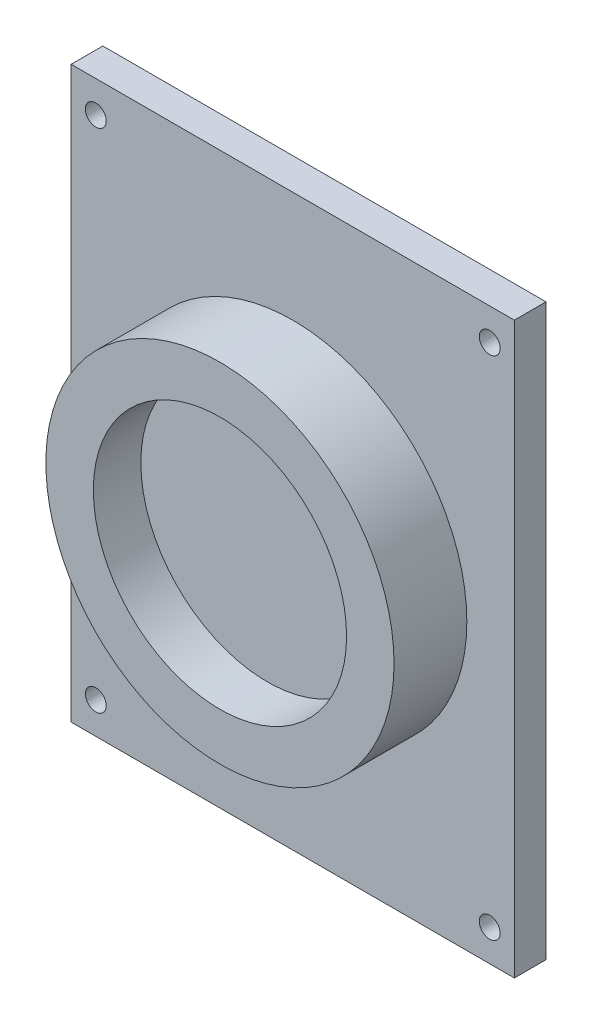
from build123d import *

# Parameters (mm, degrees)
CROQUIS1_W                                           = 140
CROQUIS1_H                                           = 180
SALIENTE_EXTRUIR1_DEPTH                              = 10
CROQUIS2_R                                           = 55
SALIENTE_EXTRUIR2_DEPTH                              = 8
CROQUIS3_R                                           = 55
CROQUIS3_R_2                                         = 40
SALIENTE_EXTRUIR3_DEPTH                              = 15
REFRENTADO_PARA_TORNILLO_CON_CABEZA_PLAN_D           = 6.6
REFRENTADO_PARA_TORNILLO_CON_CABEZA_PLAN_CBORE_D     = 11
REFRENTADO_PARA_TORNILLO_CON_CABEZA_PLAN_CBORE_DEPTH = 3.9


with BuildPart() as part:
    # Croquis1 → Saliente-Extruir1 (new body)
    with BuildSketch(Plane.XY):
        with Locations((70, 90)):
            Rectangle(CROQUIS1_W, CROQUIS1_H)
    extrude(amount=SALIENTE_EXTRUIR1_DEPTH)

    # Croquis2 → Saliente-Extruir2 (add)
    with BuildSketch(Plane.XY.offset(10)):
        with Locations((70, 90)):
            Circle(CROQUIS2_R)
    extrude(amount=SALIENTE_EXTRUIR2_DEPTH)

    # Croquis3 → Saliente-Extruir3 (add)
    with BuildSketch(Plane.XY.offset(18)):
        with Locations((70, 90)):
            Circle(CROQUIS3_R)
        with Locations((70, 90)):
            Circle(CROQUIS3_R_2, mode=Mode.SUBTRACT)
    extrude(amount=SALIENTE_EXTRUIR3_DEPTH)

    # Refrentado para tornillo con cabeza plana de M61 (through all)
    with Locations(Plane(origin=(0, 0, 0), x_dir=(-1, 0, 0), z_dir=(0, 0, -1))):
        with Locations((-132.222222222, 170), (-7.777777778, 170), (-7.777777778, 10), (-132.222222222, 10)):
            CounterBoreHole(REFRENTADO_PARA_TORNILLO_CON_CABEZA_PLAN_D / 2, REFRENTADO_PARA_TORNILLO_CON_CABEZA_PLAN_CBORE_D / 2, REFRENTADO_PARA_TORNILLO_CON_CABEZA_PLAN_CBORE_DEPTH)


solid = part.part
